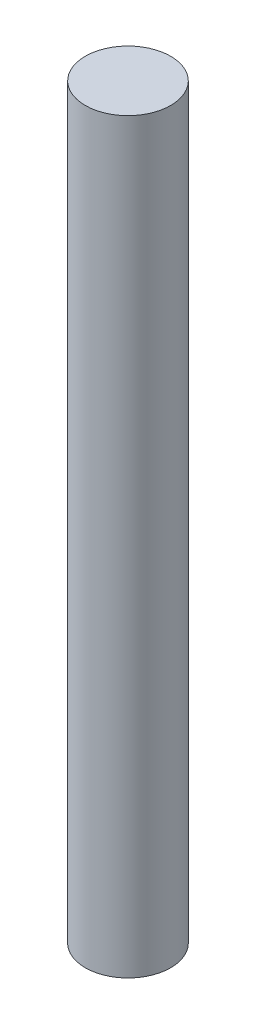
from build123d import *

# Parameters (mm, degrees)
SKETCH_1_R      = 2
EXTRUDE_1_DEPTH = 35


with BuildPart() as part:
    # 草图1 → 凸台-拉伸1 (new body)
    with BuildSketch(Plane(origin=(0, 0, 0), x_dir=(1, 0, 0), z_dir=(0, 1, 0))):
        with Locations(Location((0, 0, 0), (0, 0, 270))):
            Circle(SKETCH_1_R)
    extrude(amount=EXTRUDE_1_DEPTH)


solid = part.part
